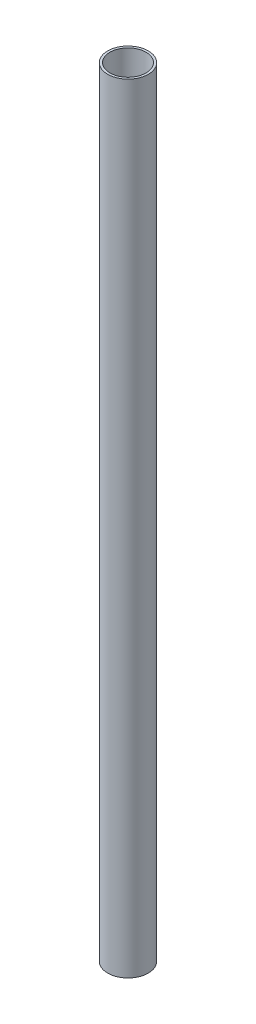
from build123d import *

# Parameters (mm, degrees)
SKETCH1_R           = 7.9375
SKETCH1_R_2         = 7.0485
BOSS_EXTRUDE1_DEPTH = 304.41


with BuildPart() as part:
    # Sketch1 → Boss-Extrude1 (new body)
    with BuildSketch(Plane(origin=(0, 0, 0), x_dir=(1, 0, 0), z_dir=(0, 1, 0))):
        with Locations(Location((13.632659162, 6.079429086, 0), (0, 0, 270))):
            Circle(SKETCH1_R)
        with Locations(Location((13.632659162, 6.079429086, 0), (0, 0, 270))):
            Circle(SKETCH1_R_2, mode=Mode.SUBTRACT)
    extrude(amount=BOSS_EXTRUDE1_DEPTH)


solid = part.part
